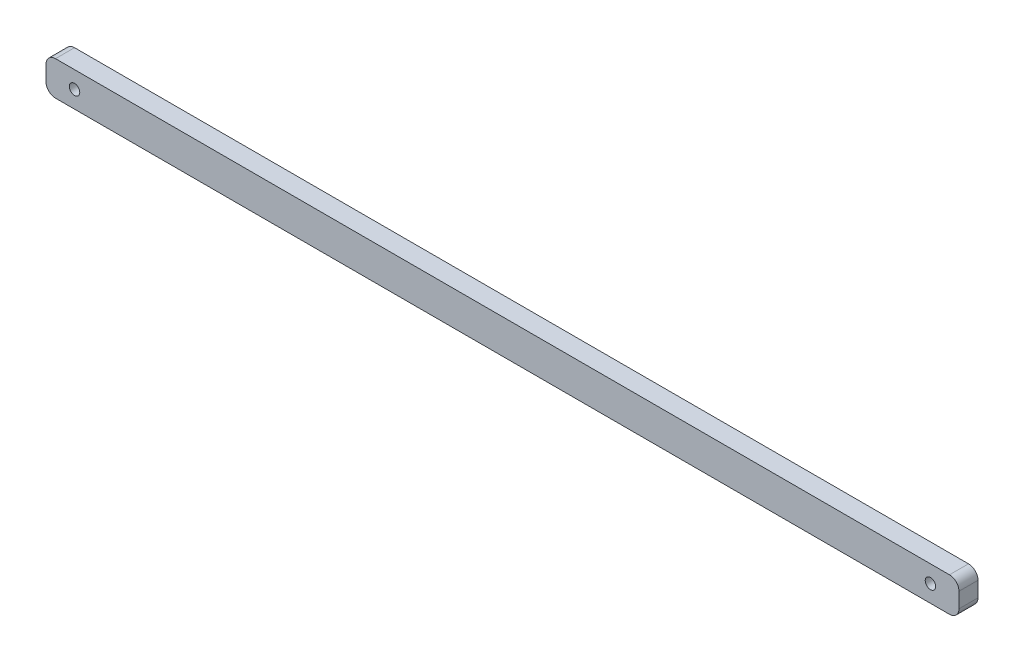
from build123d import *

# Parameters (mm, degrees)
SKETCH_1_W      = 480
SKETCH_1_H      = 18
SKETCH_1_R      = 2.75
EXTRUDE_1_DEPTH = 10
FILLET_1_R      = 5


with BuildPart() as part:
    # 草图1 → 凸台-拉伸1 (new body)
    with BuildSketch(Plane.XY):
        with Locations((240, -9)):
            Rectangle(SKETCH_1_W, SKETCH_1_H)
        with Locations((15, -9)):
            Circle(SKETCH_1_R, mode=Mode.SUBTRACT)
        with Locations(Location((465, -9, 0), (0, 0, 180))):
            Circle(SKETCH_1_R, mode=Mode.SUBTRACT)
    extrude(amount=EXTRUDE_1_DEPTH)

    # 圆角1
    fillet_1_edges = [part.edges().sort_by_distance(p)[0] for p in [
        (0, 0, 5),
        (480, 0, 5),
        (480, -18, 5),
        (0, -18, 5),
    ]]
    fillet(fillet_1_edges, radius=FILLET_1_R)


solid = part.part
